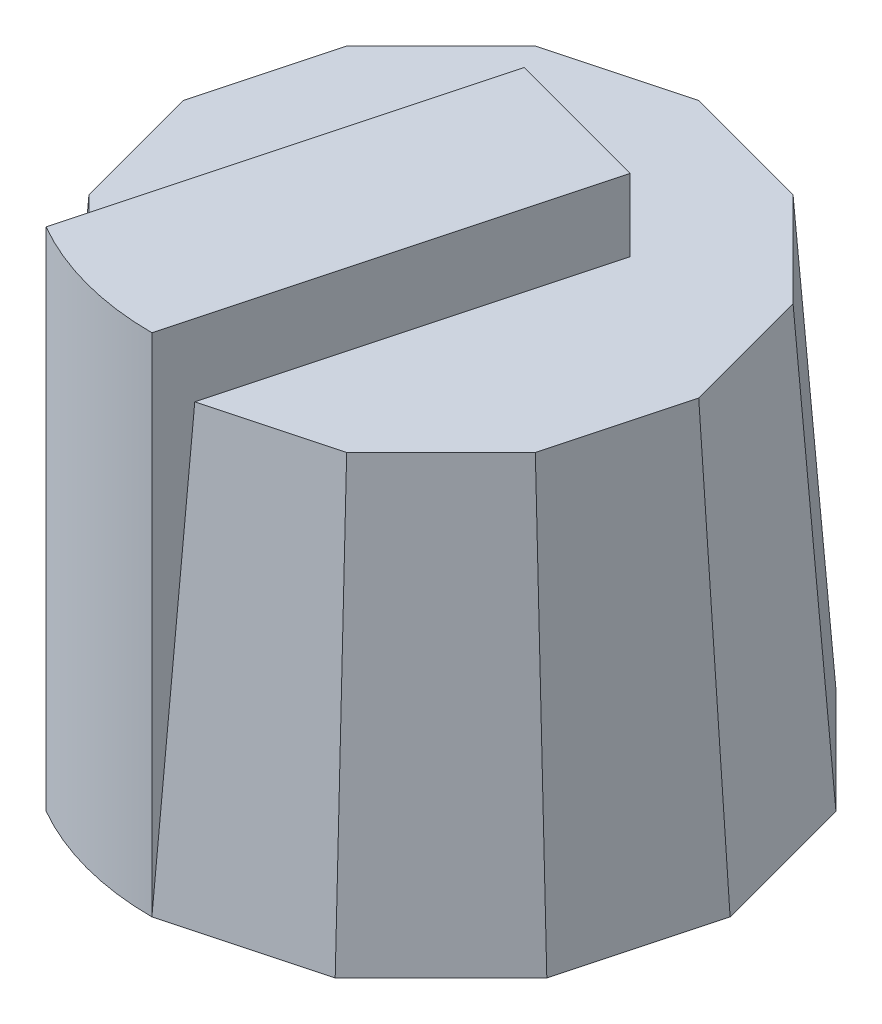
from build123d import *

# Parameters (mm, degrees)
BOSS_EXTRUDE1_DEPTH = 30
BOSS_EXTRUDE1_TAPER = 4
BOSS_EXTRUDE2_DEPTH = 35
SKETCH5_W           = 10.352761804
SKETCH5_H           = 35
BOSS_EXTRUDE3_DEPTH = 27


with BuildPart() as part:
    # Sketch1 → Boss-Extrude1 (new body)
    with BuildSketch(Plane(origin=(0, 0, 0), x_dir=(1, 0, 0), z_dir=(0, 1, 0))):
        Polygon((-20, 0), (-17.320508076, -10), (-10, -17.320508076), (0, -20), (10, -17.320508076), (17.320508076, -10), (20, 0), (17.320508076, 10), (10, 17.320508076), (0, 20), (-10, 17.320508076), (-17.320508076, 10), align=None)
    extrude(amount=BOSS_EXTRUDE1_DEPTH, taper=BOSS_EXTRUDE1_TAPER)



with BuildPart() as body_2:
    # Sketch3 → Boss-Extrude2 (new body)
    with BuildSketch(Plane(origin=(0, 0, 0), x_dir=(-1, 0, 0), z_dir=(0, -1, 0))):
        with BuildLine():
            Line((10, -17.320508076), (0, -20))
            ThreePointArc((0, -20), (5.176380902, -19.318516526), (10, -17.320508076))
        make_face()
    extrude(amount=-BOSS_EXTRUDE2_DEPTH)


with BuildPart() as part_1:
    add(part.part)

    add(body_2.part)  # Boss-Extrude3 merges body 2
    # Sketch5 → Boss-Extrude3 (add)
    with BuildSketch(Plane(origin=(-5, 0, 18.660254038), x_dir=(-0.9659258262890708, 0, -0.2588190451025115), z_dir=(0.2588190451025115, 0, -0.9659258262890709))):
        with Locations((0, 17.5)):
            Rectangle(SKETCH5_W, SKETCH5_H)
    extrude(amount=BOSS_EXTRUDE3_DEPTH)


solid = part_1.part
